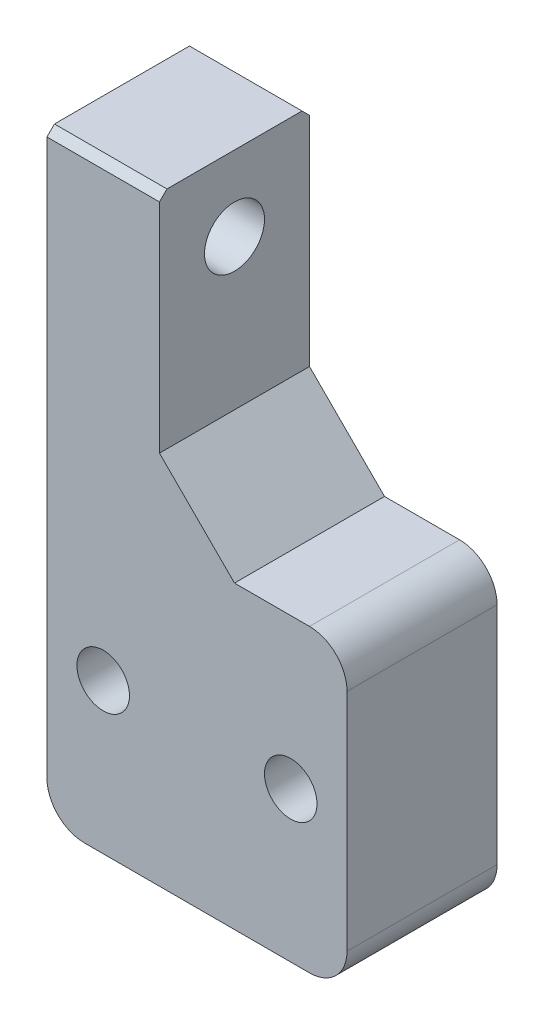
from build123d import *

# Parameters (mm, degrees)
ESQUISSE1_W                  = 40
ESQUISSE1_H                  = 40
BOSS_EXTRU_1_DEPTH           = 20
ESQUISSE2_W                  = 15
ESQUISSE2_H                  = 40
BOSS_EXTRU_2_DEPTH           = 20
ENL_V_MAT_EXTRU_1_DEPTH      = 92.651513899
ENL_V_MAT_EXTRU_1_DEPTH_BACK = 92.651513899
ESQUISSE3_R                  = 3.5
ENL_V_MAT_EXTRU_2_DEPTH      = 92.651513899
ENL_V_MAT_EXTRU_2_DEPTH_BACK = 92.651513899
ESQUISSE4_R                  = 4
CONG_1_R                     = 5
CHANFREIN1_SIZE              = 10
CHANFREIN2_SIZE              = 1


with BuildPart() as part:
    # Esquisse1 → Boss.-Extru.1 (new body)
    with BuildSketch(Plane.XY):
        with Locations((20, 20)):
            Rectangle(ESQUISSE1_W, ESQUISSE1_H)
    extrude(amount=BOSS_EXTRU_1_DEPTH)

    # Esquisse2 → Boss.-Extru.2 (add)
    with BuildSketch(Plane.XY.offset(20)):
        with Locations((7.5, 60)):
            Rectangle(ESQUISSE2_W, ESQUISSE2_H)
    extrude(amount=-BOSS_EXTRU_2_DEPTH)

    # Esquisse3 → Enlèv. mat.-Extru.1 (cut, two sides: drawn at the far end of the back side and taken through both)
    with BuildSketch(Plane.XY.offset(20).offset(-ENL_V_MAT_EXTRU_1_DEPTH_BACK)):
        with Locations((7.5, 20)):
            Circle(ESQUISSE3_R)
        with Locations(Location((32.5, 20, 0), (0, 0, 180))):
            Circle(ESQUISSE3_R)
    extrude(amount=ENL_V_MAT_EXTRU_1_DEPTH + ENL_V_MAT_EXTRU_1_DEPTH_BACK, mode=Mode.SUBTRACT)

    # Esquisse4 → Enlèv. mat.-Extru.2 (cut, two sides: drawn at the far end of the back side and taken through both)
    with BuildSketch(Plane.ZY.offset(-ENL_V_MAT_EXTRU_2_DEPTH_BACK)):
        with Locations(Location((10, 70, 0), (0, 0, 180))):
            Circle(ESQUISSE4_R)
    extrude(amount=ENL_V_MAT_EXTRU_2_DEPTH + ENL_V_MAT_EXTRU_2_DEPTH_BACK, mode=Mode.SUBTRACT)

    # Congé1
    cong_1_edges = [part.edges().sort_by_distance(p)[0] for p in [
        (40, 40, 10),
        (40, 0, 10),
        (0, 0, 10),
    ]]
    fillet(cong_1_edges, radius=CONG_1_R)

    # Chanfrein1
    chanfrein1_edges = [part.edges().sort_by_distance(p)[0] for p in [
        (15, 40, 10),
    ]]
    chamfer(chanfrein1_edges, length=CHANFREIN1_SIZE)

    # Chanfrein2
    chanfrein2_edges = [part.edges().sort_by_distance(p)[0] for p in [
        (7.5, 80, 0),
        (7.5, 80, 20),
    ]]
    chamfer(chanfrein2_edges, length=CHANFREIN2_SIZE)


solid = part.part
